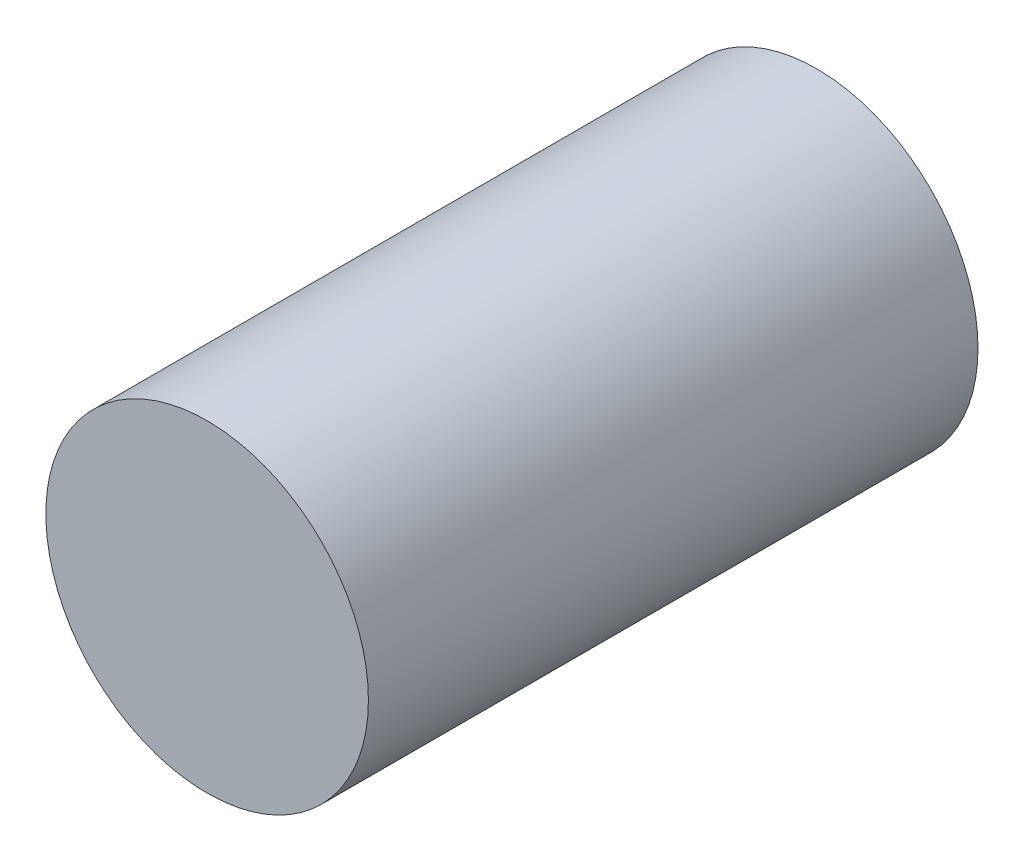
from build123d import *

# Parameters (mm, degrees)
SKETCH_1_R      = 3.175
EXTRUDE_1_DEPTH = 12


with BuildPart() as part:
    # 草图1 → 凸台-拉伸1 (new body)
    with BuildSketch(Plane.XY):
        Circle(SKETCH_1_R)
    extrude(amount=EXTRUDE_1_DEPTH)


solid = part.part
